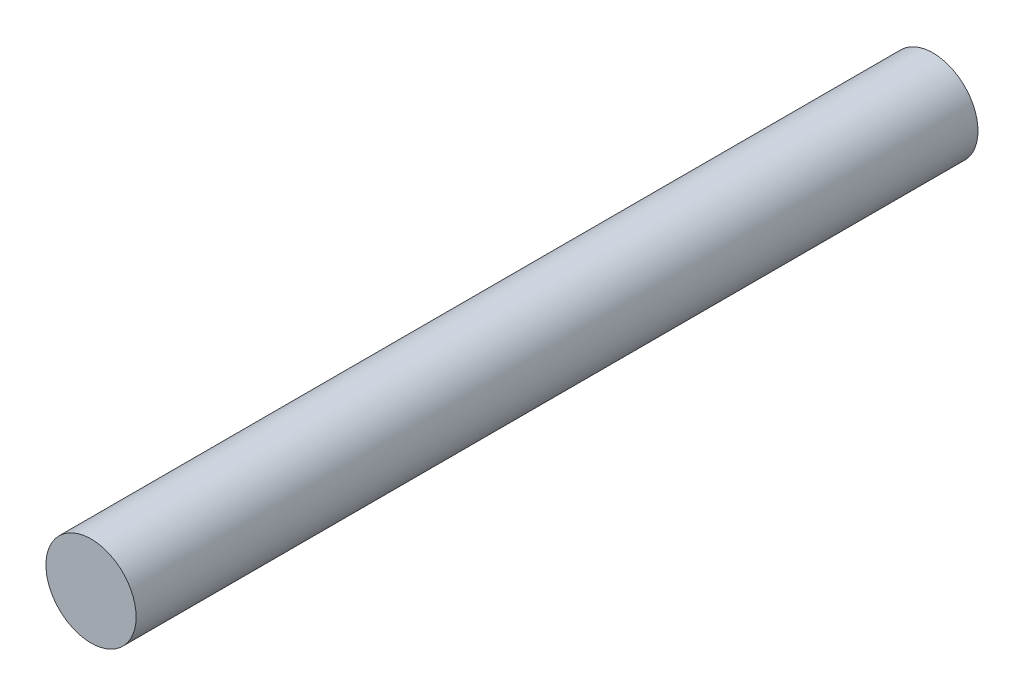
from build123d import *

# Parameters (mm, degrees)
SKETCH1_R           = 1.5
BOSS_EXTRUDE1_DEPTH = 28


with BuildPart() as part:
    # Sketch1 → Boss-Extrude1 (new body)
    with BuildSketch(Plane.XY):
        Circle(SKETCH1_R)
    extrude(amount=BOSS_EXTRUDE1_DEPTH)


solid = part.part
